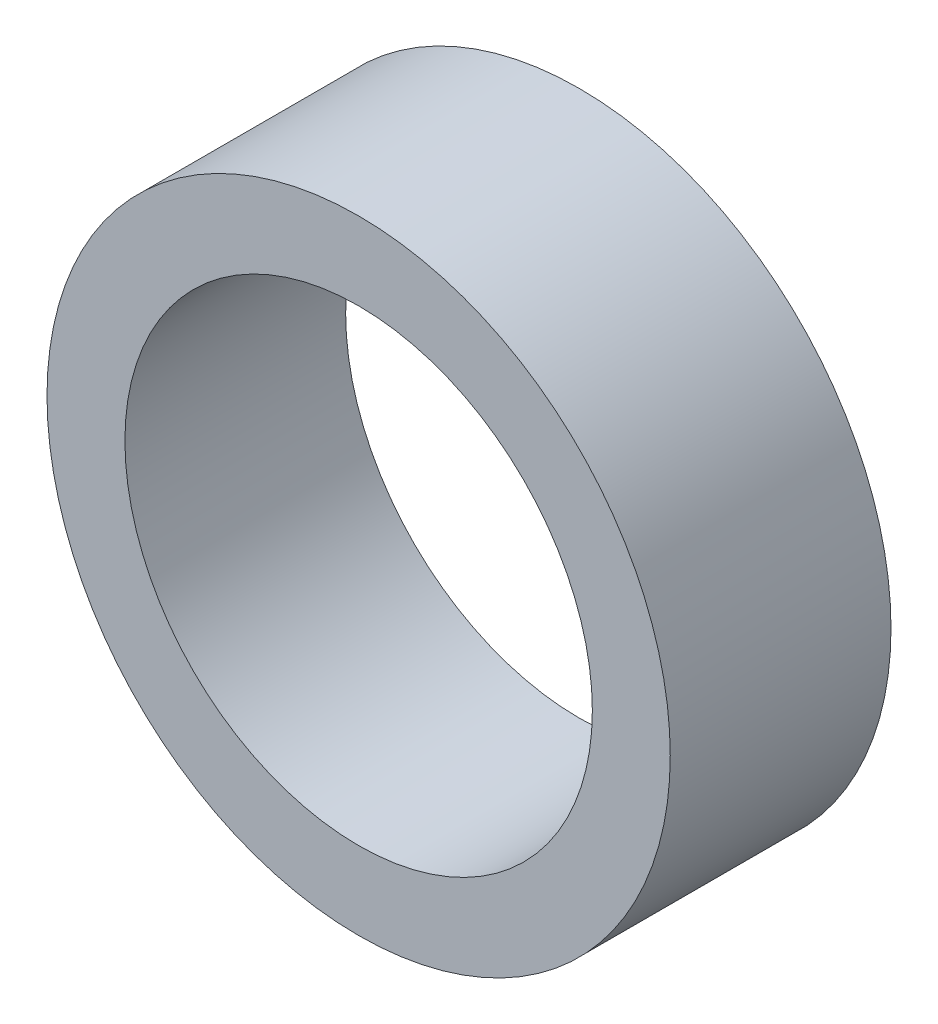
from build123d import *

# Parameters (mm, degrees)
SKETCH1_R      = 24
SKETCH1_R_2    = 18
EXTRUDE1_DEPTH = 8.5


with BuildPart() as part:
    # Sketch1 → Extrude1 (new, symmetric)
    with BuildSketch(Plane.XY):
        Circle(SKETCH1_R)
        Circle(SKETCH1_R_2, mode=Mode.SUBTRACT)
    extrude(amount=EXTRUDE1_DEPTH, both=True)


solid = part.part
